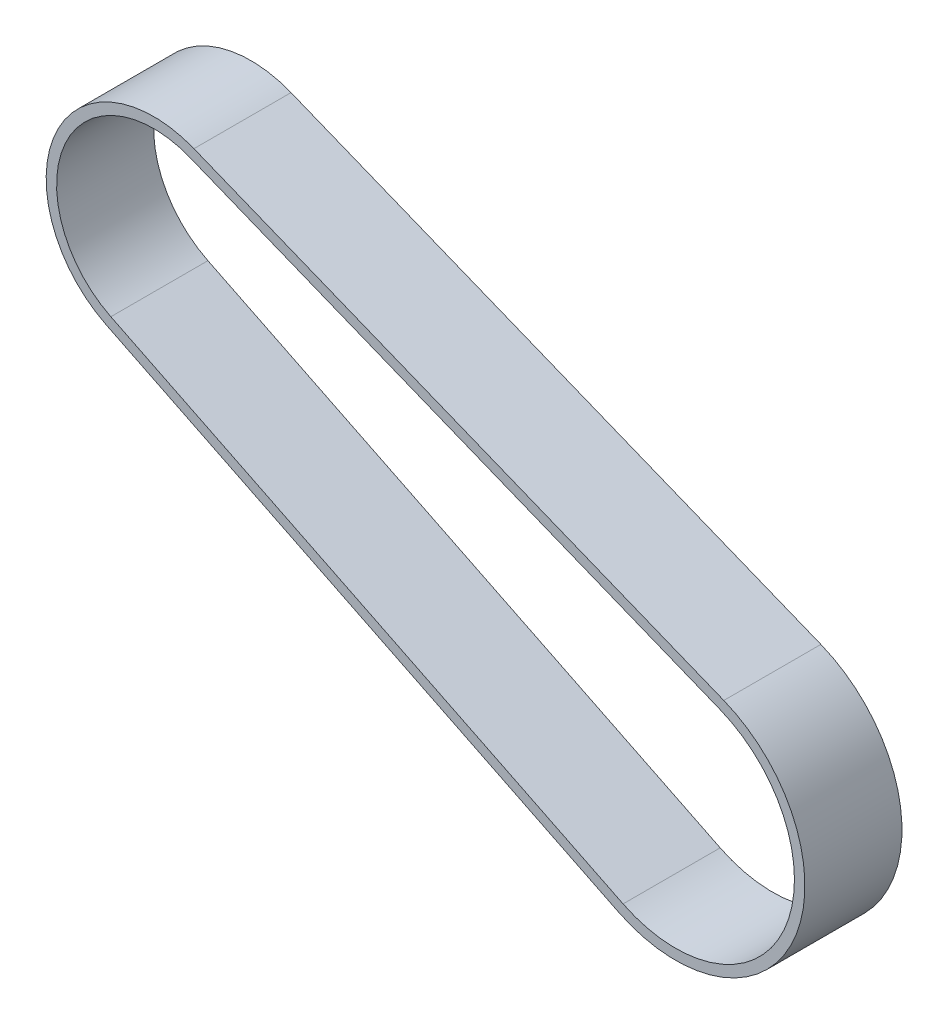
from build123d import *

# Parameters (mm, degrees)
BOSS_EXTRUDE1_DEPTH = 40


with BuildPart() as part:
    # Sketch1 → Boss-Extrude1 (new body)
    with BuildSketch(Plane.XY):
        with BuildLine():
            Line((-19.602881157, -39.788102183), (191.462311598, -143.776120279))
            ThreePointArc((191.462311598, -143.776120279), (263.640289972, -117.71118523), (234.862749113, -46.571220769))
            Line((234.862749113, -46.571220769), (16.537669036, 41.156670515))
            ThreePointArc((16.537669036, 41.156670515), (-40.501394274, 18.083226672), (-19.602881157, -39.788102183))
        make_face()
        with BuildLine():
            Line((193.362714911, -139.918858654), (-17.702477843, -35.930840558))
            ThreePointArc((-17.702477843, -35.930840558), (-36.574982474, 16.330146417), (14.934423024, 37.166732893))
            Line((14.934423024, 37.166732893), (233.259503101, -50.561158391))
            ThreePointArc((233.259503101, -50.561158391), (259.713878173, -115.958104976), (193.362714911, -139.918858654))
        make_face(mode=Mode.SUBTRACT)
    extrude(amount=BOSS_EXTRUDE1_DEPTH)


solid = part.part
